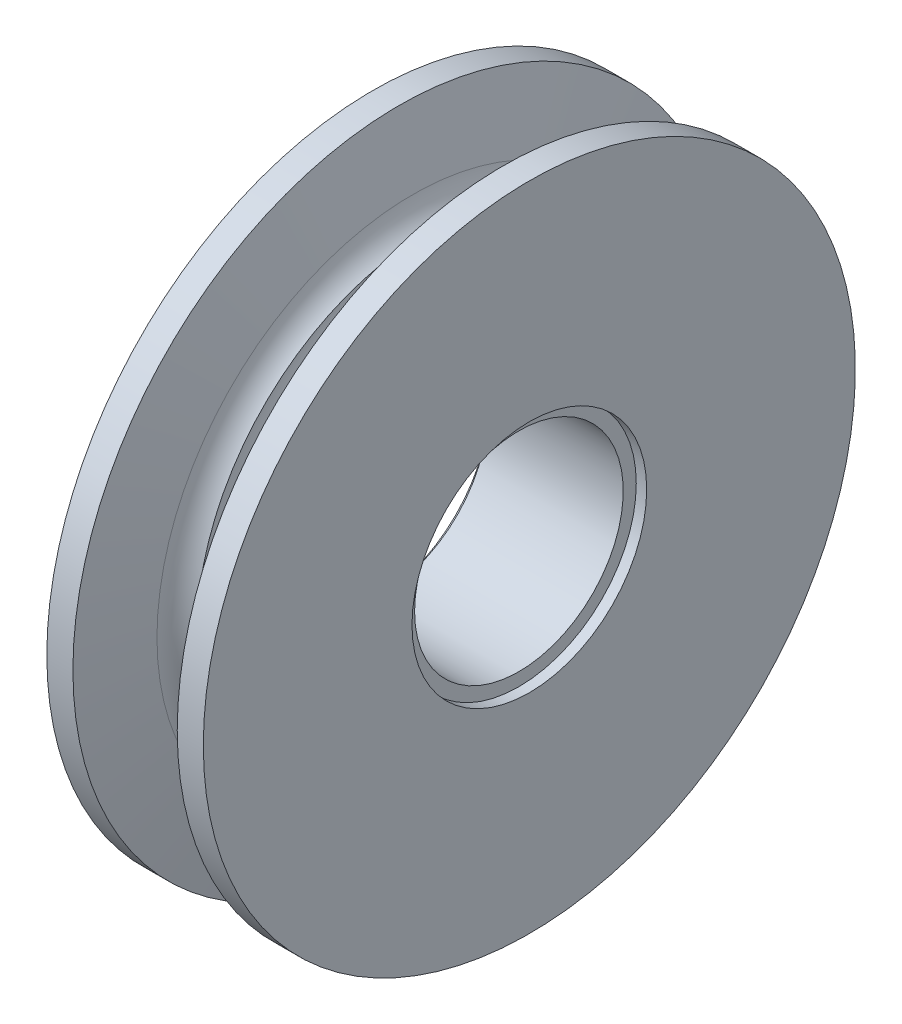
from build123d import *

# Parameters (mm, degrees)
SKETCH_4_R          = 8
CUT_EXTRUDE_1_DEPTH = 38.336309405
SKETCH_5_R          = 9
CUT_EXTRUDE_2_DEPTH = 0.8


with BuildPart() as part:
    # Эскиз1 → Повернуть1 (revolve)
    with BuildSketch(Plane.XY, mode=Mode.PRIVATE) as revolve_1_sk:
        with BuildLine():
            Line((-4, 25), (-2.94403514, 19.609934257))
            ThreePointArc((-2.94403514, 19.609934257), (-2.52454557, 18.565998224), (-1.75, 17.75))
            ThreePointArc((-1.75, 17.75), (0, 16), (1.75, 17.75))
            ThreePointArc((1.75, 17.75), (2.52454557, 18.565998224), (2.94403514, 19.609934257))
            Line((2.94403514, 19.609934257), (4, 25))
            Line((4, 25), (6, 25))
            Line((6, 25), (6, 0))
            Line((6, 0), (-6, 0))
            Line((-6, 0), (-6, 25))
            Line((-6, 25), (-4, 25))
        make_face()
    revolve(revolve_1_sk.sketch.rotate(Axis((-6, 0, 0), (1, 0, 0)), 90), axis=Axis((-6, 0, 0), (1, 0, 0)))

    # Эскиз4 → Вырез-Вытянуть1 (cut, through all)
    with BuildSketch(Plane.ZY.offset(6)):
        Circle(SKETCH_4_R)
    extrude(amount=-CUT_EXTRUDE_1_DEPTH, mode=Mode.SUBTRACT)

    # Эскиз5 → Вырез-Вытянуть2 (cut)
    with BuildSketch(Plane.ZY.offset(6)):
        Circle(SKETCH_5_R)
    cut_extrude_2 = extrude(amount=-CUT_EXTRUDE_2_DEPTH, mode=Mode.SUBTRACT)

    # Зеркальное отражение1: Вырез-Вытянуть2 across plane
    add(cut_extrude_2.mirror(Plane(origin=(0, 0, 0), x_dir=(0, 0, 1), z_dir=(1, 0, 0))), mode=Mode.SUBTRACT)


solid = part.part
